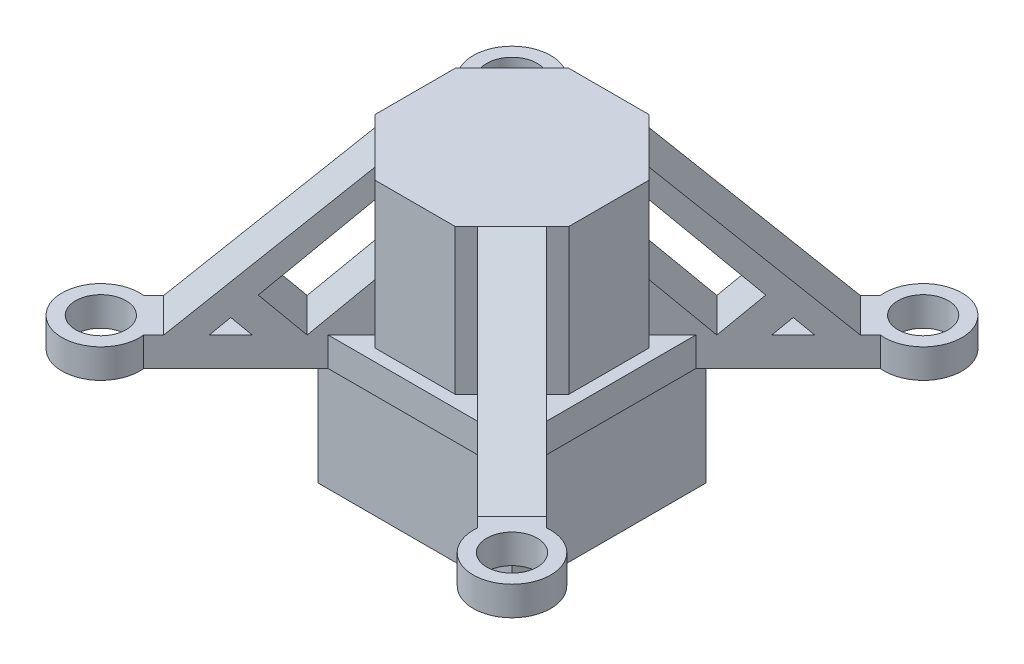
from build123d import *

# Parameters (mm, degrees)
SKETCH1_W               = 20
SKETCH1_H               = 20
BOSS_EXTRUDE1_DEPTH     = 12
BOSS_EXTRUDE2_DEPTH     = 3
BOSS_EXTRUDE3_DEPTH     = 15
BOSS_EXTRUDE4_DEPTH     = 15
BODY_MOVE_COPY1_ANGLE   = 45
CUT_EXTRUDE2_DEPTH      = 15
CUT_EXTRUDE2_DEPTH_BACK = 15
CUT_EXTRUDE3_DEPTH      = 15
CUT_EXTRUDE3_DEPTH_BACK = 15
CUT_EXTRUDE4_DEPTH      = 15
CUT_EXTRUDE4_DEPTH_BACK = 15
CUT_EXTRUDE5_DEPTH      = 15
CUT_EXTRUDE5_DEPTH_BACK = 15
SKETCH10_R              = 2.6
CUT_EXTRUDE6_DEPTH      = 25
BODY_MOVE_COPY2_ANGLE   = 45


with BuildPart() as part:
    # Sketch1 → Boss-Extrude1 (new body)
    with BuildSketch(Plane(origin=(0, 0, 0), x_dir=(1, 0, 0), z_dir=(0, 1, 0))):
        Rectangle(SKETCH1_W, SKETCH1_H)
    extrude(amount=-BOSS_EXTRUDE1_DEPTH)

    # Sketch2 → Boss-Extrude2 (add)
    with BuildSketch(Plane(origin=(0, 0, 0), x_dir=(1, 0, 0), z_dir=(0, 1, 0))):
        with BuildLine():
            Line((7.714466094, -11.25), (17.237496266, -20.773030172))
            ThreePointArc((17.237496266, -20.773030172), (24.04163056, -24.04163056), (20.773030172, -17.237496266))
            Line((20.773030172, -17.237496266), (11.25, -7.714466094))
            Line((11.25, -7.714466094), (11.25, 7.714466094))
            Line((11.25, 7.714466094), (20.773030172, 17.237496266))
            ThreePointArc((20.773030172, 17.237496266), (24.04163056, 24.04163056), (17.237496266, 20.773030172))
            Line((17.237496266, 20.773030172), (7.714466094, 11.25))
            Line((7.714466094, 11.25), (-7.714466094, 11.25))
            Line((-7.714466094, 11.25), (-17.237496266, 20.773030172))
            ThreePointArc((-17.237496266, 20.773030172), (-24.04163056, 24.04163056), (-20.773030172, 17.237496266))
            Line((-20.773030172, 17.237496266), (-11.25, 7.714466094))
            Line((-11.25, 7.714466094), (-11.25, -7.714466094))
            Line((-11.25, -7.714466094), (-20.773030172, -17.237496266))
            ThreePointArc((-20.773030172, -17.237496266), (-24.04163056, -24.04163056), (-17.237496266, -20.773030172))
            Line((-17.237496266, -20.773030172), (-7.714466094, -11.25))
            Line((-7.714466094, -11.25), (7.714466094, -11.25))
        make_face()
    extrude(amount=BOSS_EXTRUDE2_DEPTH)

    # Sketch3 → Boss-Extrude3 (add)
    with BuildSketch(Plane(origin=(0, 3, 0), x_dir=(1, 0, 0), z_dir=(0, 1, 0))):
        Polygon((10, 4.142135624), (4.142135624, 10), (-4.142135624, 10), (-10, 4.142135624), (-10, -4.142135624), (-4.142135624, -10), (4.142135624, -10), (10, -4.142135624), align=None)
    extrude(amount=BOSS_EXTRUDE3_DEPTH)

    # Sketch4 → Boss-Extrude4 (add)
    with BuildSketch(Plane(origin=(0, 3, 0), x_dir=(1, 0, 0), z_dir=(0, 1, 0))):
        Polygon((-11.25, -7.714466094), (-19.735281374, -16.199747468), (-16.199747468, -19.735281374), (-7.714466094, -11.25), (-5.303300859, -8.838834765), (-8.838834765, -5.303300859), align=None)
        Polygon((-7.714466094, 11.25), (-16.199747468, 19.735281374), (-19.735281374, 16.199747468), (-11.25, 7.714466094), (-8.838834765, 5.303300859), (-5.303300859, 8.838834765), align=None)
        Polygon((11.25, 7.714466094), (19.735281374, 16.199747468), (16.199747468, 19.735281374), (7.714466094, 11.25), (5.303300859, 8.838834765), (8.838834765, 5.303300859), align=None)
        Polygon((7.714466094, -11.25), (16.199747468, -19.735281374), (19.735281374, -16.199747468), (11.25, -7.714466094), (8.838834765, -5.303300859), (5.303300859, -8.838834765), align=None)
    extrude(amount=BOSS_EXTRUDE4_DEPTH)


with BuildPart() as part_1:
    # Body-Move/Copy1: moved
    add(part.part.rotate(Axis((0, 0, 0), (0, 1, 0)), BODY_MOVE_COPY1_ANGLE))

    # Sketch5 → Cut-Extrude2 (cut, two sides: drawn at the far end of the back side and taken through both)
    with BuildSketch(Plane.XY.offset(-CUT_EXTRUDE2_DEPTH_BACK)):
        Polygon((-25.409902577, 18), (-10, 18), (-25.409902577, 3), align=None)
        Polygon((10, 18), (25.409902577, 3), (25.409902577, 18), align=None)
    extrude(amount=CUT_EXTRUDE2_DEPTH + CUT_EXTRUDE2_DEPTH_BACK, mode=Mode.SUBTRACT)

    # Sketch7 → Cut-Extrude3 (cut, two sides: drawn at the far end of the back side and taken through both)
    with BuildSketch(Plane(origin=(0, 0, 0), x_dir=(0, 0, -1), z_dir=(1, 0, 0)).offset(-CUT_EXTRUDE3_DEPTH_BACK)):
        Polygon((-25.409902577, 18), (-10, 18), (-25.409902577, 3), align=None)
        Polygon((10, 18), (25.409902577, 3), (25.409902577, 18), align=None)
    extrude(amount=CUT_EXTRUDE3_DEPTH + CUT_EXTRUDE3_DEPTH_BACK, mode=Mode.SUBTRACT)

    # Sketch8 → Cut-Extrude4 (cut, two sides: drawn at the far end of the back side and taken through both)
    with BuildSketch(Plane(origin=(2.5, 0, 0), x_dir=(0, 0, -1), z_dir=(1, 0, 0)).offset(-CUT_EXTRUDE4_DEPTH_BACK)):
        Polygon((-10, 7.94465349), (-10, 15.084865647), (-18.514759568, 6.570106079), (-14.94465349, 3), align=None)
        Polygon((-18.955808103, 3), (-22.084865647, 3), (-20.674172955, 4.410692692), (-20.520336875, 4.564528772), align=None)
        Polygon((14.94465349, 3), (10, 7.94465349), (10, 15.084865647), (18.514759568, 6.570106079), align=None)
        Polygon((20.674172955, 4.410692692), (20.520336875, 4.564528772), (18.955808103, 3), (22.084865647, 3), align=None)
    extrude(amount=CUT_EXTRUDE4_DEPTH + CUT_EXTRUDE4_DEPTH_BACK, mode=Mode.SUBTRACT)

    # Sketch9 → Cut-Extrude5 (cut, two sides: drawn at the far end of the back side and taken through both)
    with BuildSketch(Plane.XY.offset(-CUT_EXTRUDE5_DEPTH_BACK)):
        Polygon((-10, 7.94465349), (-10, 15.084865647), (-18.514759568, 6.570106079), (-14.94465349, 3), align=None)
        Polygon((-18.955808103, 3), (-22.084865647, 3), (-20.674172955, 4.410692692), (-20.520336875, 4.564528772), align=None)
        Polygon((14.94465349, 3), (10, 7.94465349), (10, 15.084865647), (18.514759568, 6.570106079), align=None)
        Polygon((20.674172955, 4.410692692), (20.520336875, 4.564528772), (18.955808103, 3), (22.084865647, 3), align=None)
    extrude(amount=CUT_EXTRUDE5_DEPTH + CUT_EXTRUDE5_DEPTH_BACK, mode=Mode.SUBTRACT)

    # Sketch10 → Cut-Extrude6 (cut)
    with BuildSketch(Plane(origin=(0, 0, 0), x_dir=(1, 0, 0), z_dir=(0, 1, 0))):
        with Locations(Location((0, -30, 0), (0, 0, 270))):
            Circle(SKETCH10_R)
        with Locations(Location((-30, 0, 0), (0, 0, 270))):
            Circle(SKETCH10_R)
        with Locations(Location((0, 30, 0), (0, 0, 270))):
            Circle(SKETCH10_R)
        with Locations(Location((30, 0, 0), (0, 0, 270))):
            Circle(SKETCH10_R)
    extrude(amount=CUT_EXTRUDE6_DEPTH, mode=Mode.SUBTRACT)


with BuildPart() as part_2:
    # Body-Move/Copy2: moved
    add(part_1.part.rotate(Axis((0, 0, 0), (0, 1, 0)), BODY_MOVE_COPY2_ANGLE))


solid = part_2.part
